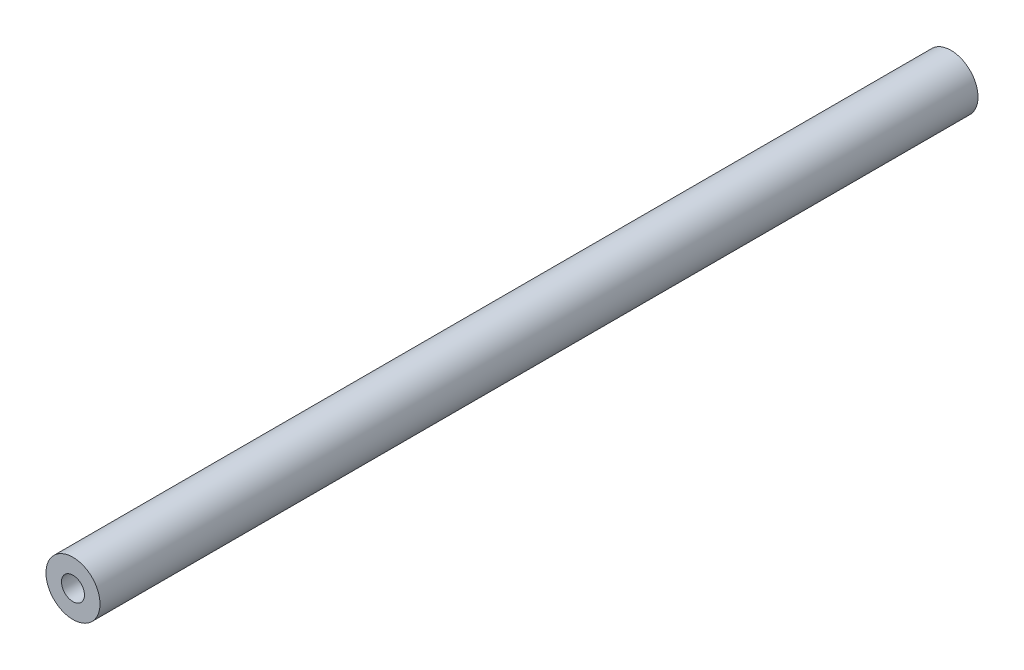
from build123d import *

# Parameters (mm, degrees)
SKETCH_1_R             = 8
EXTRUDE_1_DEPTH        = 260
HOLE_WIZARD_M8_2_D     = 6.8
HOLE_WIZARD_M8_2_DEPTH = 26.25
HOLE_WIZARD_M8_2_TIP   = 2.042926105


with BuildPart() as part:
    # 草图1 → 凸台-拉伸1 (new body)
    with BuildSketch(Plane.XY):
        Circle(SKETCH_1_R)
    extrude(amount=EXTRUDE_1_DEPTH)

    # 草图5 → M8 螺纹孔1 (revolve, cut)
    with BuildSketch(Plane(origin=(0, 0, 260), x_dir=(0, -1, 0), z_dir=(1, 0, 0))):
        Polygon((0, 0), (0, 28.292926105), (3.4, 26.25), (3.4, 0), align=None)
    revolve(axis=Axis((0, 0, 266.35), (0, 0, -1)), mode=Mode.SUBTRACT)

    # M8 螺纹孔2
    with Locations(Plane(origin=(0, 0, 0), x_dir=(-1, 0, 0), z_dir=(0, 0, -1))):
        with Locations((0, 0)):
            Hole(HOLE_WIZARD_M8_2_D / 2, depth=HOLE_WIZARD_M8_2_DEPTH)
            with Locations((0, 0, -(HOLE_WIZARD_M8_2_DEPTH + HOLE_WIZARD_M8_2_TIP / 2))):  # 118° drill point
                Cone(0, HOLE_WIZARD_M8_2_D / 2, HOLE_WIZARD_M8_2_TIP, mode=Mode.SUBTRACT)


solid = part.part
